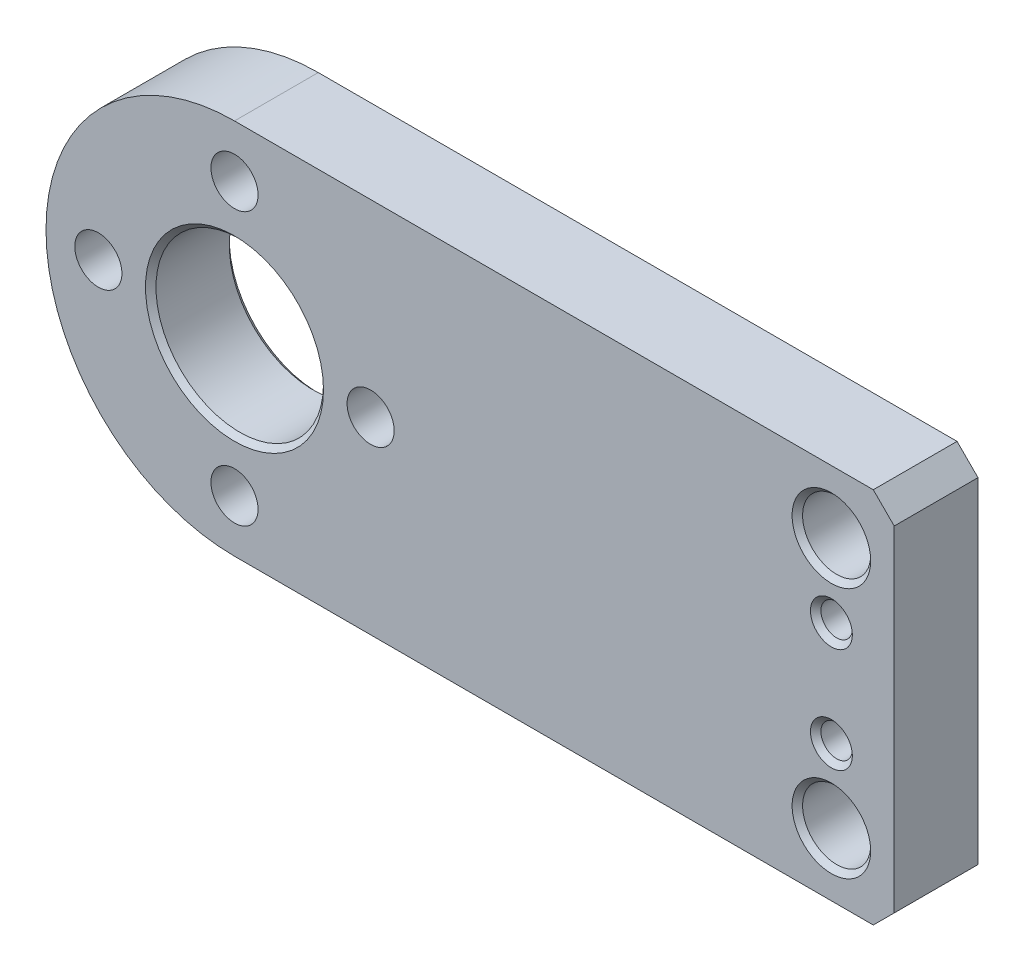
from build123d import *

# Parameters (mm, degrees)
SKETCH1_R           = 8
SKETCH1_R_2         = 2.25
SKETCH1_R_3         = 3.25
SKETCH1_R_4         = 1.5
BOSS_EXTRUDE1_DEPTH = 8
CHAMFER2_SIZE       = 2
CHAMFER3_SIZE       = 0.5


with BuildPart() as part:
    # Sketch1 → Boss-Extrude1 (new body)
    with BuildSketch(Plane.XY):
        with BuildLine():
            Line((-31.5, -18), (31.5, -18))
            Line((31.5, -18), (31.5, 18))
            Line((31.5, 18), (-31.5, 18))
            ThreePointArc((-31.5, 18), (-49.5, 0), (-31.5, -18))
        make_face()
        with Locations((-31.5, 0)):
            Circle(SKETCH1_R, mode=Mode.SUBTRACT)
        with Locations((-31.5, 13)):
            Circle(SKETCH1_R_2, mode=Mode.SUBTRACT)
        with Locations((-18.5, 0)):
            Circle(SKETCH1_R_2, mode=Mode.SUBTRACT)
        with Locations((-31.5, -13)):
            Circle(SKETCH1_R_2, mode=Mode.SUBTRACT)
        with Locations((-44.5, 0)):
            Circle(SKETCH1_R_2, mode=Mode.SUBTRACT)
        with Locations((25.5, 12)):
            Circle(SKETCH1_R_3, mode=Mode.SUBTRACT)
        with Locations((25.5, 5)):
            Circle(SKETCH1_R_4, mode=Mode.SUBTRACT)
        with Locations((25.5, -5)):
            Circle(SKETCH1_R_4, mode=Mode.SUBTRACT)
        with Locations((25.5, -12)):
            Circle(SKETCH1_R_3, mode=Mode.SUBTRACT)
    extrude(amount=BOSS_EXTRUDE1_DEPTH)

    # Chamfer2
    chamfer2_edges = [part.edges().sort_by_distance(p)[0] for p in [
        (31.5, 18, 4),
        (31.5, -18, 4),
    ]]
    chamfer(chamfer2_edges, length=CHAMFER2_SIZE)

    # Chamfer3
    chamfer3_edges = [part.edges().sort_by_distance(p)[0] for p in [
        (-39.5, 0, 8),
        (22.25, -12, 0),
        (22.25, 12, 0),
        (24, 5, 0),
        (24, -5, 0),
        (-39.5, 0, 0),
        (24, -5, 8),
        (24, 5, 8),
        (22.25, 12, 8),
        (22.25, -12, 8),
    ]]
    chamfer(chamfer3_edges, length=CHAMFER3_SIZE)


solid = part.part
